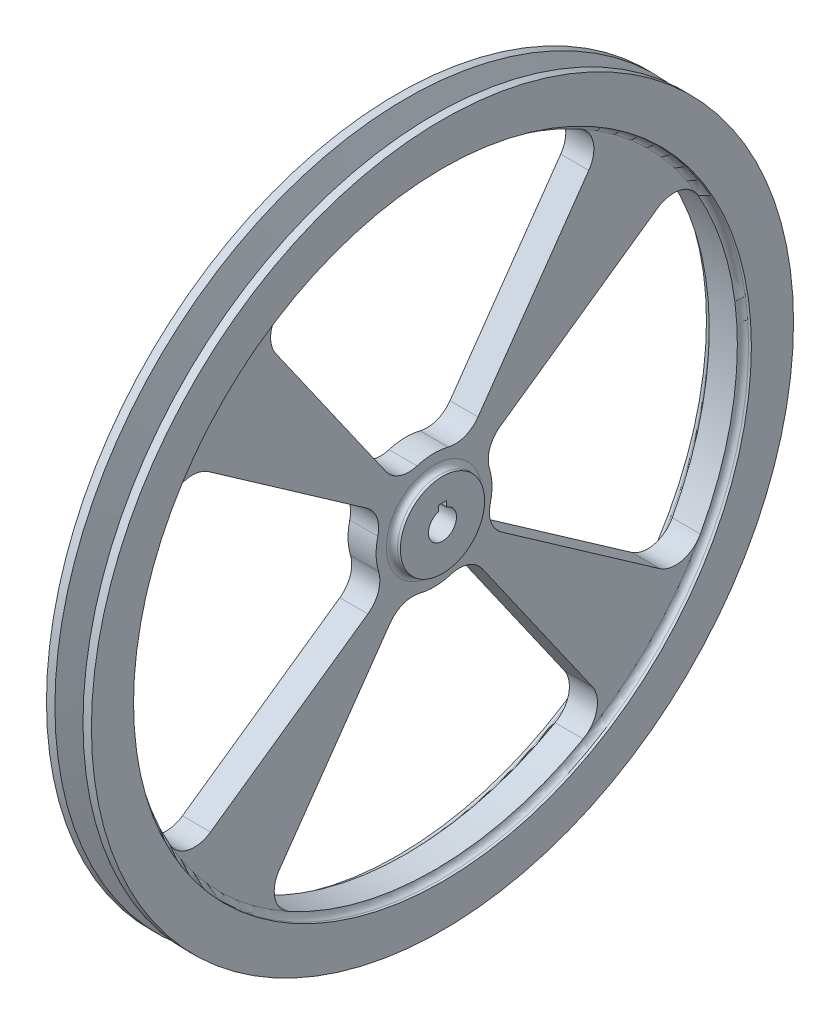
from build123d import *

# Parameters (mm, degrees)
FILLET1_R          = 2
CUT_EXTRUDE1_DEPTH = 40
CIRPATTERN1_COUNT  = 4
SKETCH5_W          = 3
SKETCH5_H          = 5
CUT_EXTRUDE2_DEPTH = 178.499295773


with BuildPart() as part:
    # Sketch1 → Revolve1 (revolve)
    with BuildSketch(Plane(origin=(0, 0, 0), x_dir=(1, 0, 0), z_dir=(0, 1, 0))):
        Polygon((-5, 15), (-5, 110), (-8, 110), (-8, 125), (-5, 125), (-1.942693185, 115), (1.942693185, 115), (5, 125), (8, 125), (8, 110), (5, 110), (5, 15), (8, 15), (8, 5), (-8, 5), (-8, 15), align=None)
    revolve(axis=Axis((0, 0, 0), (-1, 0, 0)))

    # Fillet1
    fillet1_edges = [part.edges().sort_by_distance(p)[0] for p in [
        (-5, 0, 110),
        (-5, 0, 15),
        (5, 0, 15),
        (5, 0, 110),
    ]]
    fillet(fillet1_edges, radius=FILLET1_R)

    # Sketch4 → Cut-Extrude1 (cut)
    with BuildSketch(Plane(origin=(5, 0, 0), x_dir=(0, 0, -1), z_dir=(1, 0, 0))):
        with BuildLine():
            Line((-17.153489429, 23.561464434), (-56.387719646, 79.593752114))
            ThreePointArc((-56.387719646, 79.593752114), (-57.948828756, 87.539995339), (-53.114178714, 94.036609996))
            ThreePointArc((-53.114178714, 94.036609996), (-0.808048061, 107.99697708), (51.701121513, 94.820852318))
            ThreePointArc((51.701121513, 94.820852318), (56.649798569, 88.324529217), (55.105501075, 80.305379407))
            Line((55.105501075, 80.305379407), (15.663534482, 23.976413435))
            ThreePointArc((15.663534482, 23.976413435), (10.964602801, 20.341915063), (5.033152704, 20.01413906))
            ThreePointArc((5.033152704, 20.01413906), (-0.520914556, 20.630730391), (-6.036787164, 19.734629188))
            ThreePointArc((-6.036787164, 19.734629188), (-12.216926377, 19.841793727), (-17.153489429, 23.561464434))
        make_face()
    cut_extrude1 = extrude(amount=-CUT_EXTRUDE1_DEPTH, mode=Mode.SUBTRACT)

    # CirPattern1: Cut-Extrude1 ×4 about axis
    cirpattern1_axis = Axis((0, 0, 0), (1, 0, 0))
    for i in range(1, CIRPATTERN1_COUNT):
        add(cut_extrude1.rotate(cirpattern1_axis, i * 360 / CIRPATTERN1_COUNT), mode=Mode.SUBTRACT)

    # Sketch5 → Cut-Extrude2 (cut, through all)
    with BuildSketch(Plane(origin=(8, 0, 0), x_dir=(0, 0, -1), z_dir=(1, 0, 0))):
        with Locations((0, 4.3)):
            Rectangle(SKETCH5_W, SKETCH5_H)
    extrude(amount=-CUT_EXTRUDE2_DEPTH, mode=Mode.SUBTRACT)


solid = part.part
